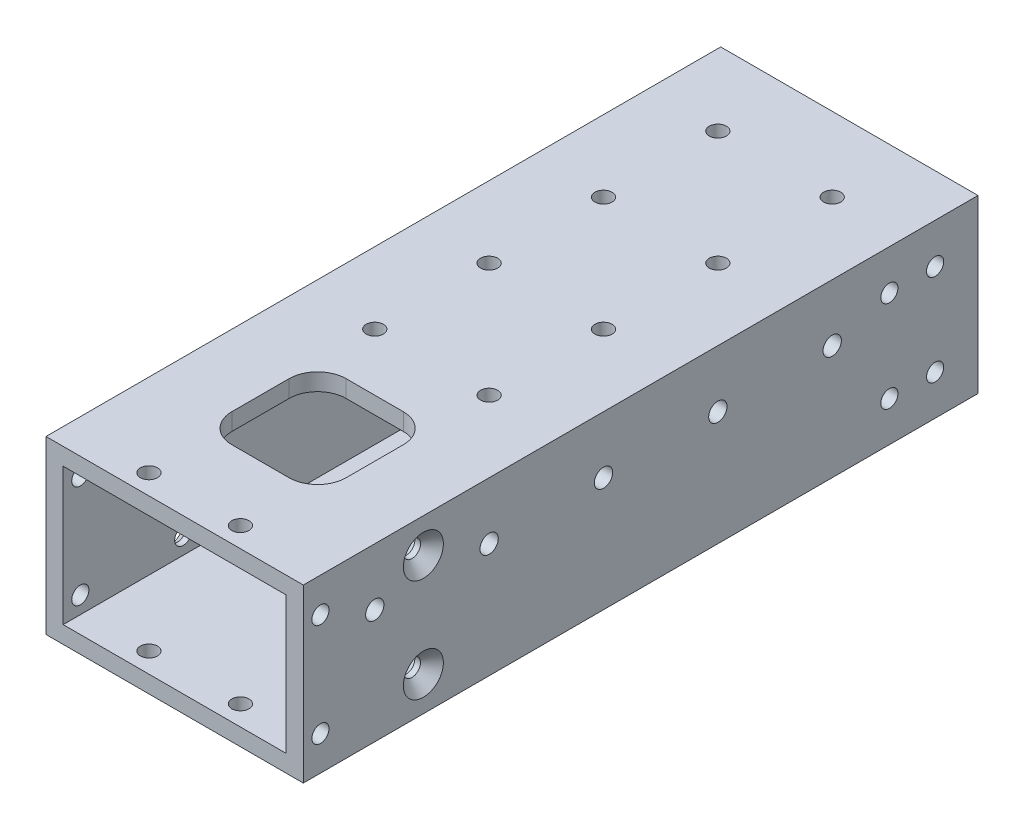
from build123d import *

# Parameters (mm, degrees)
SKETCH_1_W          = 45
SKETCH_1_H          = 30
SKETCH_1_W_2        = 39
SKETCH_1_H_2        = 24
EXTRUDE_1_DEPTH     = 118
SKETCH_2_R          = 1.5
CUT_EXTRUDE_1_DEPTH = 59
SKETCH_3_W          = 31
SKETCH_3_H          = 26
CUT_EXTRUDE_2_DEPTH = 10
SKETCH_4_R          = 1.6
CUT_EXTRUDE_3_DEPTH = 50
CHAMFER_1_SIZE      = 2
FILLET_1_R          = 2
SKETCH_5_W          = 20
SKETCH_5_H          = 20
CUT_EXTRUDE_4_DEPTH = 3
SKETCH_6_R          = 1.5
CUT_EXTRUDE_5_DEPTH = 42
FILLET_2_R          = 5
SKETCH_7_R          = 1.5
CUT_EXTRUDE_6_DEPTH = 30


with BuildPart() as part:
    # 草图1 → 拉伸-薄壁1 (new body)
    with BuildSketch(Plane.XY):
        Rectangle(SKETCH_1_W, SKETCH_1_H)
        Rectangle(SKETCH_1_W_2, SKETCH_1_H_2, mode=Mode.SUBTRACT)
    extrude(amount=EXTRUDE_1_DEPTH)

    # 草图2 → 切除-拉伸1 (cut)
    with BuildSketch(Plane.ZY.offset(22.5)):
        with Locations((15.5, 8)):
            Circle(SKETCH_2_R)
        with Locations((15.5, -8)):
            Circle(SKETCH_2_R)
        with Locations((7.5, -8)):
            Circle(SKETCH_2_R)
        with Locations((7.5, 8)):
            Circle(SKETCH_2_R)
        with Locations((115, 9)):
            Circle(SKETCH_2_R)
        with Locations((97, 9)):
            Circle(SKETCH_2_R)
        with Locations((97, -9)):
            Circle(SKETCH_2_R)
        with Locations((115, -9)):
            Circle(SKETCH_2_R)
    extrude(amount=-CUT_EXTRUDE_1_DEPTH, mode=Mode.SUBTRACT)

    # 草图3 → 切除-拉伸2 (cut)
    with BuildSketch(Plane(origin=(0, -12, 0), x_dir=(1, 0, 0), z_dir=(0, 1, 0))):
        with Locations((0, -13)):
            Rectangle(SKETCH_3_W, SKETCH_3_H)
    extrude(amount=-CUT_EXTRUDE_2_DEPTH, mode=Mode.SUBTRACT)

    # 草图4 → 切除-拉伸3 (cut)
    with BuildSketch(Plane(origin=(22.5, 0, 0), x_dir=(0, 0, -1), z_dir=(1, 0, 0))):
        with Locations((-25.5, 5)):
            Circle(SKETCH_4_R)
        with Locations((-45.5, 5)):
            Circle(SKETCH_4_R)
        with Locations((-65.5, 5)):
            Circle(SKETCH_4_R)
        with Locations((-85.5, 5)):
            Circle(SKETCH_4_R)
        with Locations((-105.5, 5)):
            Circle(SKETCH_4_R)
    extrude(amount=-CUT_EXTRUDE_3_DEPTH, mode=Mode.SUBTRACT)

    # 倒角1
    chamfer_1_edges = [part.edges().sort_by_distance(p)[0] for p in [
        (22.5, 9, 95.5),
        (-22.5, 9, 95.5),
        (22.5, -9, 95.5),
        (-22.5, -9, 95.5),
    ]]
    chamfer(chamfer_1_edges, length=CHAMFER_1_SIZE)

    # 圆角1
    fillet_1_edges = [part.edges().sort_by_distance(p)[0] for p in [
        (15.5, -13.5, 0),
        (15.5, -13.5, 26),
        (-15.5, -13.5, 26),
        (-15.5, -13.5, 0),
    ]]
    fillet(fillet_1_edges, radius=FILLET_1_R)

    # 草图5 → 切除-拉伸4 (cut)
    with BuildSketch(Plane(origin=(0, 15, 0), x_dir=(1, 0, 0), z_dir=(0, 1, 0))):
        with Locations((0, -93)):
            Rectangle(SKETCH_5_W, SKETCH_5_H)
    extrude(amount=-CUT_EXTRUDE_4_DEPTH, mode=Mode.SUBTRACT)

    # 草图6 → 切除-拉伸5 (cut)
    with BuildSketch(Plane(origin=(0, 15, 0), x_dir=(1, 0, 0), z_dir=(0, 1, 0))):
        with Locations(Location((10, -73, 0), (0, 0, 270))):
            Circle(SKETCH_6_R)
        with Locations(Location((-10, -73, 0), (0, 0, 270))):
            Circle(SKETCH_6_R)
        with Locations(Location((-10, -53, 0), (0, 0, 270))):
            Circle(SKETCH_6_R)
        with Locations(Location((10, -53, 0), (0, 0, 270))):
            Circle(SKETCH_6_R)
        with Locations(Location((-10, -33, 0), (0, 0, 270))):
            Circle(SKETCH_6_R)
        with Locations(Location((10, -33, 0), (0, 0, 270))):
            Circle(SKETCH_6_R)
        with Locations(Location((-10, -13, 0), (0, 0, 270))):
            Circle(SKETCH_6_R)
        with Locations(Location((10, -13, 0), (0, 0, 270))):
            Circle(SKETCH_6_R)
    extrude(amount=-CUT_EXTRUDE_5_DEPTH, mode=Mode.SUBTRACT)

    # 圆角2
    fillet_2_edges = [part.edges().sort_by_distance(p)[0] for p in [
        (10, 13.5, 83),
        (10, 13.5, 103),
        (-10, 13.5, 103),
        (-10, 13.5, 83),
    ]]
    fillet(fillet_2_edges, radius=FILLET_2_R)

    # 草图7 → 切除-拉伸6 (cut)
    with BuildSketch(Plane(origin=(0, 15, 0), x_dir=(1, 0, 0), z_dir=(0, 1, 0))):
        with Locations(Location((8, -114.5, 0), (0, 0, 270))):
            Circle(SKETCH_7_R)
        with Locations(Location((-8, -114.5, 0), (0, 0, 270))):
            Circle(SKETCH_7_R)
    extrude(amount=-CUT_EXTRUDE_6_DEPTH, mode=Mode.SUBTRACT)


solid = part.part
